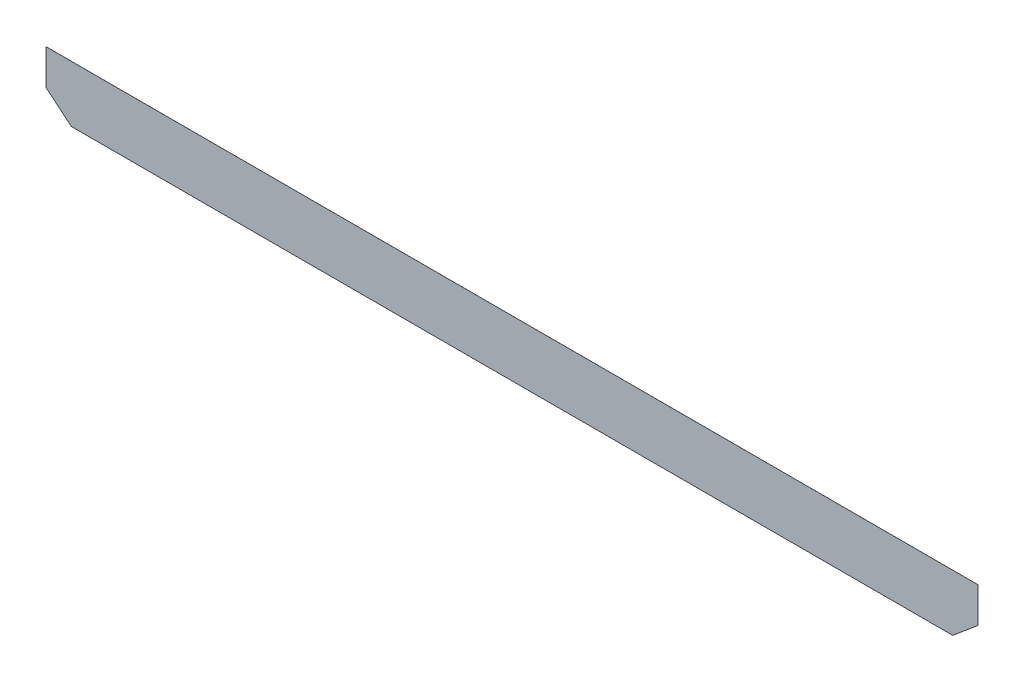
from build123d import *

# Parameters (mm, degrees)
SKETCH1_W           = 33
SKETCH1_H           = 2
BOSS_EXTRUDE1_DEPTH = 0.001
CUT_EXTRUDE1_DEPTH  = 1


with BuildPart() as part:
    # Sketch1 → Boss-Extrude1 (new body)
    with BuildSketch(Plane.XY):
        with Locations((16.5, 1)):
            Rectangle(SKETCH1_W, SKETCH1_H)
    extrude(amount=BOSS_EXTRUDE1_DEPTH)

    # Sketch2 → Cut-Extrude1 (cut)
    with BuildSketch(Plane(origin=(0, 0, 0), x_dir=(-1, 0, 0), z_dir=(0, 0, -1))):
        Polygon((-33, 0), (-32.106184806, 0), (-33, 0.75), align=None)
        Polygon((0, 0), (-0.893815194, 0), (0, 0.75), align=None)
    extrude(amount=-CUT_EXTRUDE1_DEPTH, mode=Mode.SUBTRACT)


solid = part.part
